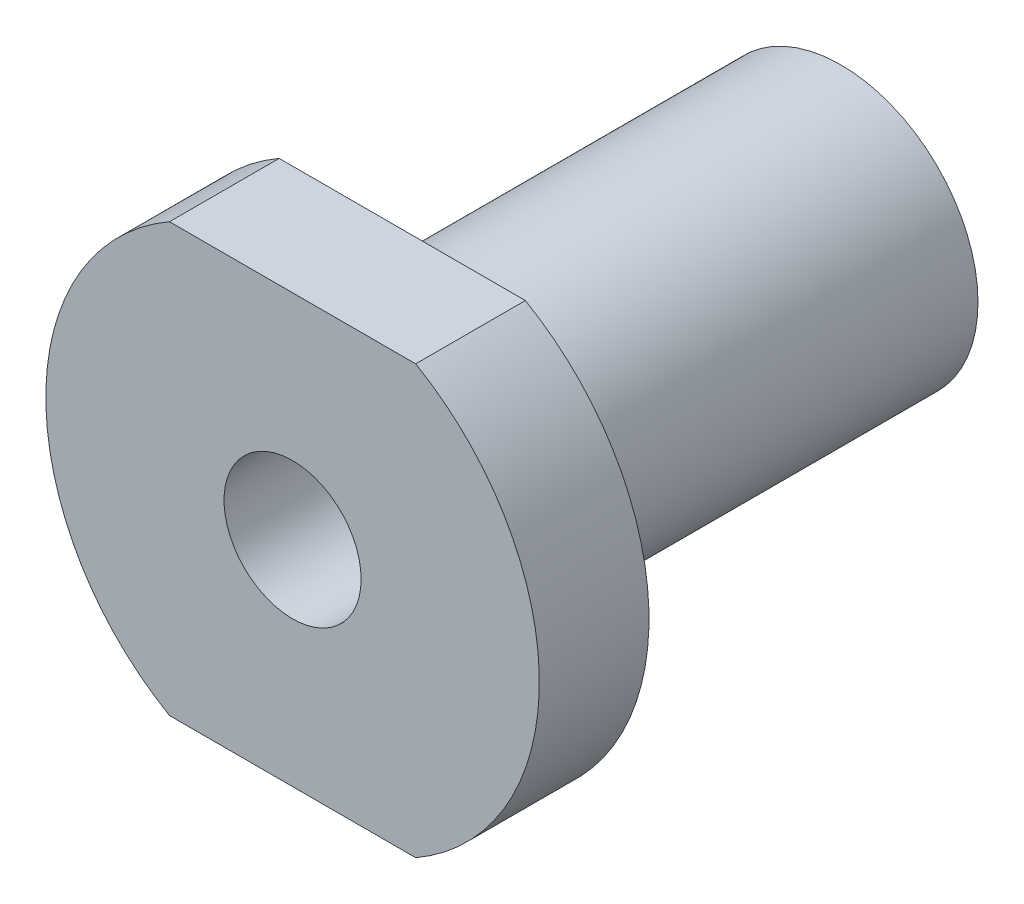
from build123d import *

# Parameters (mm, degrees)
SKETCH1_R           = 4.5
SKETCH1_R_2         = 2.3
BOSS_EXTRUDE1_DEPTH = 2
SKETCH2_R           = 2.5
SKETCH2_R_2         = 1.25
BOSS_EXTRUDE2_DEPTH = 10
SKETCH3_R           = 9.569639601
SKETCH3_W           = 11
SKETCH3_H           = 7.8
CUT_EXTRUDE1_DEPTH  = 10


with BuildPart() as part:
    # Sketch1 → Boss-Extrude1 (new body)
    with BuildSketch(Plane.XY):
        Circle(SKETCH1_R)
        Circle(SKETCH1_R_2, mode=Mode.SUBTRACT)
    extrude(amount=BOSS_EXTRUDE1_DEPTH)

    # Sketch2 → Boss-Extrude2 (add)
    with BuildSketch(Plane.XY.offset(2)):
        Circle(SKETCH2_R)
        Circle(SKETCH2_R_2, mode=Mode.SUBTRACT)
    extrude(amount=-BOSS_EXTRUDE2_DEPTH)

    # Sketch3 → Cut-Extrude1 (cut)
    with BuildSketch(Plane.XY.offset(2)):
        Circle(SKETCH3_R)
        Rectangle(SKETCH3_W, SKETCH3_H, mode=Mode.SUBTRACT)
    extrude(amount=-CUT_EXTRUDE1_DEPTH, mode=Mode.SUBTRACT)


solid = part.part
